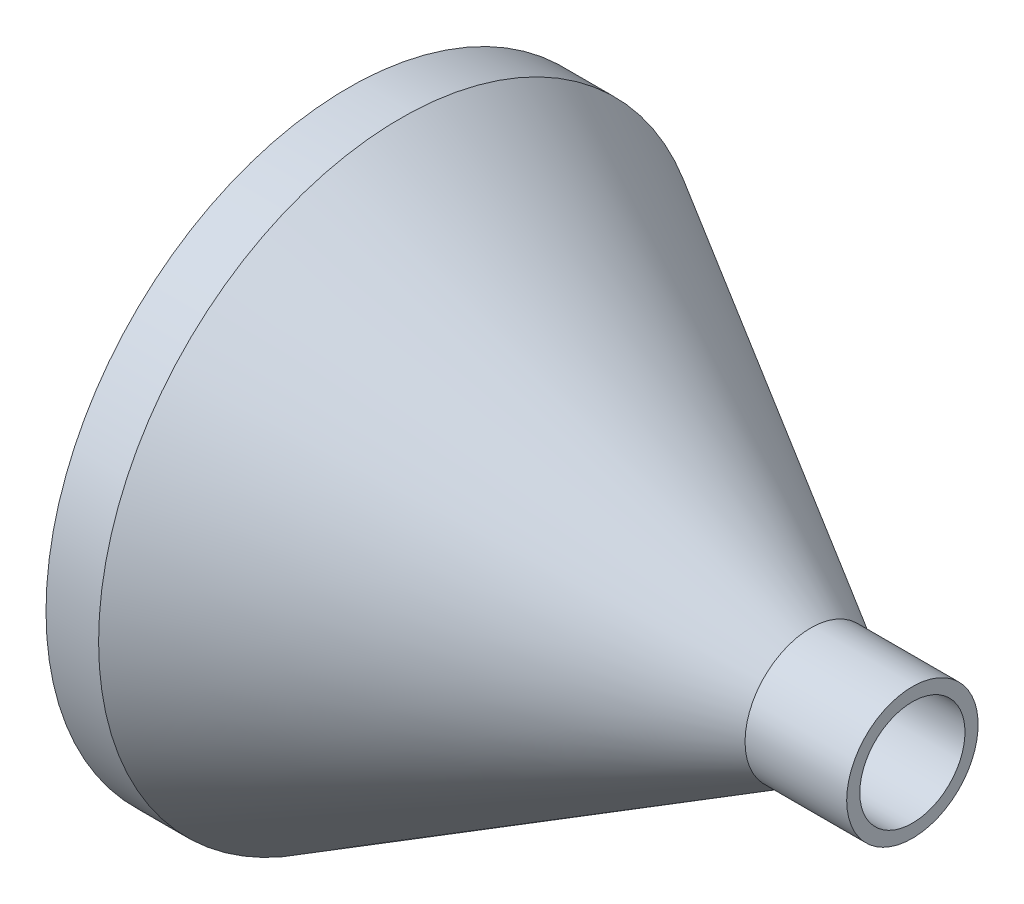
from build123d import *


with BuildPart() as part:
    # Sketch1 → Revolve1 (revolve)
    with BuildSketch(Plane.XY, mode=Mode.PRIVATE) as revolve1_sk:
        Polygon((0, 73.025), (0, 69.85), (11.849261314, 69.85), (110.835964967, 12.7), (136.235964967, 12.7), (136.235964967, 15.875), (111.686703653, 15.875), (12.7, 73.025), align=None)
    revolve(revolve1_sk.sketch.rotate(Axis((0, 0, 0), (1, 0, 0)), 90), axis=Axis((0, 0, 0), (1, 0, 0)))


solid = part.part
